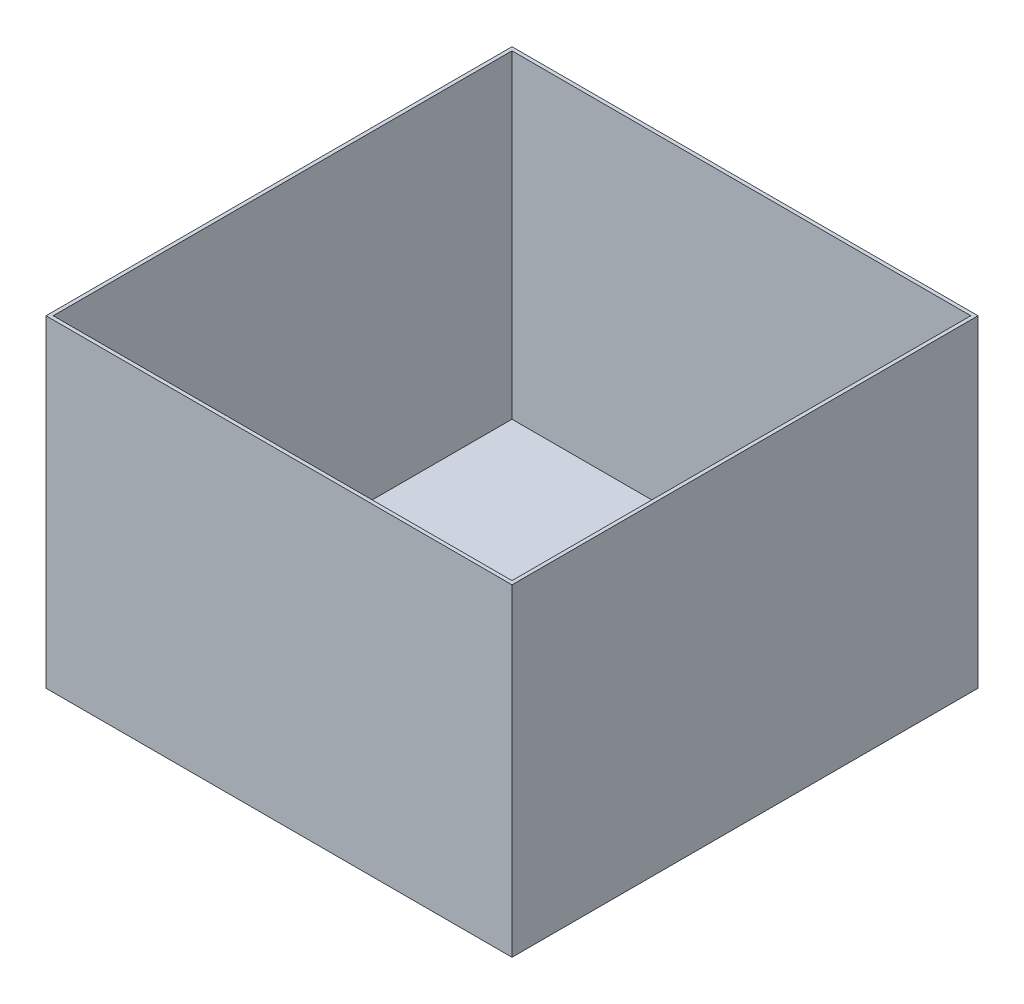
from build123d import *

# Parameters (mm, degrees)
SKETCH_1_W        = 260
SKETCH_1_H        = 260
EXTRUDE_282_DEPTH = 2
SKETCH_1_3_W      = 260
SKETCH_1_3_H      = 260
SKETCH_1_3_W_2    = 256
SKETCH_1_3_H_2    = 256
EXTRUDE_337_DEPTH = 180


with BuildPart() as part:
    # 草图1 → Extrude 282 (new body)
    with BuildSketch(Plane(origin=(0, 0, 0), x_dir=(1, 0, 0), z_dir=(0, 1, 0))):
        Rectangle(SKETCH_1_W, SKETCH_1_H)
    extrude(amount=EXTRUDE_282_DEPTH)

    # 草图1<3> → Extrude 337 (add)
    with BuildSketch(Plane(origin=(0, 0, 0), x_dir=(1, 0, 0), z_dir=(0, 1, 0))):
        Rectangle(SKETCH_1_3_W, SKETCH_1_3_H)
        Rectangle(SKETCH_1_3_W_2, SKETCH_1_3_H_2, mode=Mode.SUBTRACT)
    extrude(amount=EXTRUDE_337_DEPTH)


solid = part.part
